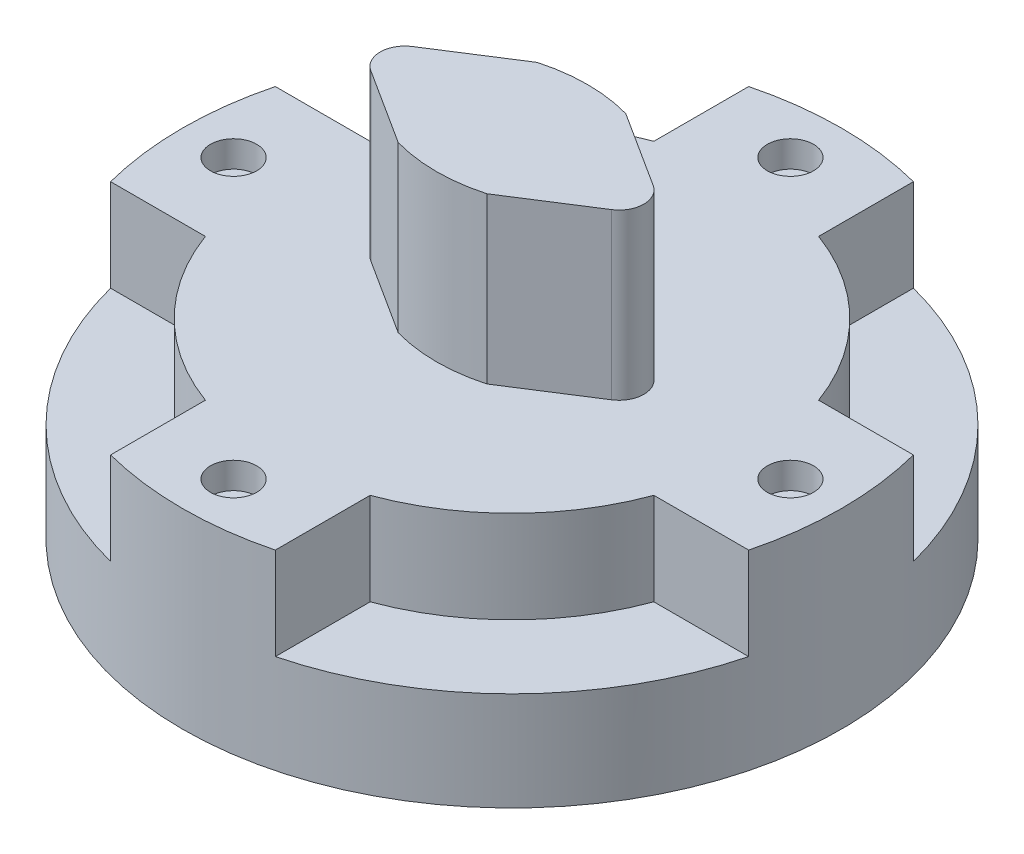
from build123d import *

# Parameters (mm, degrees)
SKETCH2_R           = 100
SKETCH2_R_2         = 4.25
BOSS_EXTRUDE1_DEPTH = 58
SKETCH3_R           = 7
CUT_EXTRUDE1_DEPTH  = 8
CUT_EXTRUDE2_START  = -28
CUT_EXTRUDE2_DEPTH  = 28
BOSS_EXTRUDE2_DEPTH = 50


with BuildPart() as part:
    # Sketch2 → Boss-Extrude1 (new body)
    with BuildSketch(Plane(origin=(0, 0, 0), x_dir=(1, 0, 0), z_dir=(0, 1, 0))):
        with Locations(Location((0, 0, 0), (0, 0, 90))):
            Circle(SKETCH2_R)
        with Locations(Location((0, 84.5, 0), (0, 0, 90))):
            Circle(SKETCH2_R_2, mode=Mode.SUBTRACT)
        with Locations(Location((84.5, 0, 0), (0, 0, 90))):
            Circle(SKETCH2_R_2, mode=Mode.SUBTRACT)
        with Locations(Location((0, -84.5, 0), (0, 0, 90))):
            Circle(SKETCH2_R_2, mode=Mode.SUBTRACT)
        with Locations(Location((-84.5, 0, 0), (0, 0, 90))):
            Circle(SKETCH2_R_2, mode=Mode.SUBTRACT)
    extrude(amount=BOSS_EXTRUDE1_DEPTH)

    # Sketch3 → Cut-Extrude1 (cut)
    with BuildSketch(Plane(origin=(0, 58, 0), x_dir=(1, 0, 0), z_dir=(0, 1, 0))):
        with Locations(Location((0, 84.5, 0), (0, 0, 270))):
            Circle(SKETCH3_R)
        with Locations(Location((84.5, 0, 0), (0, 0, 270))):
            Circle(SKETCH3_R)
        with Locations(Location((0, -84.5, 0), (0, 0, 270))):
            Circle(SKETCH3_R)
        with Locations(Location((-84.5, 0, 0), (0, 0, 270))):
            Circle(SKETCH3_R)
    extrude(amount=-CUT_EXTRUDE1_DEPTH, mode=Mode.SUBTRACT)

    # Sketch4 → Cut-Extrude2 (cut)
    with BuildSketch(Plane(origin=(0, 58, 0), x_dir=(1, 0, 0), z_dir=(0, 1, 0)).offset(CUT_EXTRUDE2_START)):
        with BuildLine():
            Line((-25, 68.053287944), (-25, 96.824583655))
            ThreePointArc((-25, 96.824583655), (-70.710678119, 70.710678119), (-96.824583655, 25))
            Line((-96.824583655, 25), (-68.053287944, 25))
            ThreePointArc((-68.053287944, 25), (-51.265241636, 51.265241636), (-25, 68.053287944))
        make_face()
        with BuildLine():
            Line((68.053287944, 25), (96.824583655, 25))
            ThreePointArc((96.824583655, 25), (70.710678119, 70.710678119), (25, 96.824583655))
            Line((25, 96.824583655), (25, 68.053287944))
            ThreePointArc((25, 68.053287944), (51.265241636, 51.265241636), (68.053287944, 25))
        make_face()
        with BuildLine():
            ThreePointArc((25, -96.824583655), (70.710678119, -70.710678119), (96.824583655, -25))
            Line((96.824583655, -25), (68.053287944, -25))
            ThreePointArc((68.053287944, -25), (51.265241636, -51.265241636), (25, -68.053287944))
            Line((25, -68.053287944), (25, -96.824583655))
        make_face()
        with BuildLine():
            ThreePointArc((-96.824583655, -25), (-70.710678119, -70.710678119), (-25, -96.824583655))
            Line((-25, -96.824583655), (-25, -68.053287944))
            ThreePointArc((-25, -68.053287944), (-51.265241636, -51.265241636), (-68.053287944, -25))
            Line((-68.053287944, -25), (-68.372754715, -25))
            Line((-68.372754715, -25), (-96.824583655, -25))
        make_face()
    extrude(amount=CUT_EXTRUDE2_DEPTH, mode=Mode.SUBTRACT)

    # Sketch5 → Boss-Extrude2 (add)
    with BuildSketch(Plane(origin=(0, 58, 0), x_dir=(1, 0, 0), z_dir=(0, 1, 0))):
        with BuildLine():
            Line((-36.538461538, 6.319875664), (-13.461538462, 21.066252212))
            ThreePointArc((-13.461538462, 21.066252212), (0, 22.912467498), (13.461538462, 21.066252212))
            Line((13.461538462, 21.066252212), (36.538461538, 6.319875664))
            ThreePointArc((36.538461538, 6.319875664), (40, 0), (36.538461538, -6.319875664))
            Line((36.538461538, -6.319875664), (13.461538462, -21.066252212))
            ThreePointArc((13.461538462, -21.066252212), (0, -22.912467498), (-13.461538462, -21.066252212))
            Line((-13.461538462, -21.066252212), (-36.538461538, -6.319875664))
            ThreePointArc((-36.538461538, -6.319875664), (-40, 0), (-36.538461538, 6.319875664))
        make_face()
    extrude(amount=BOSS_EXTRUDE2_DEPTH)


solid = part.part
